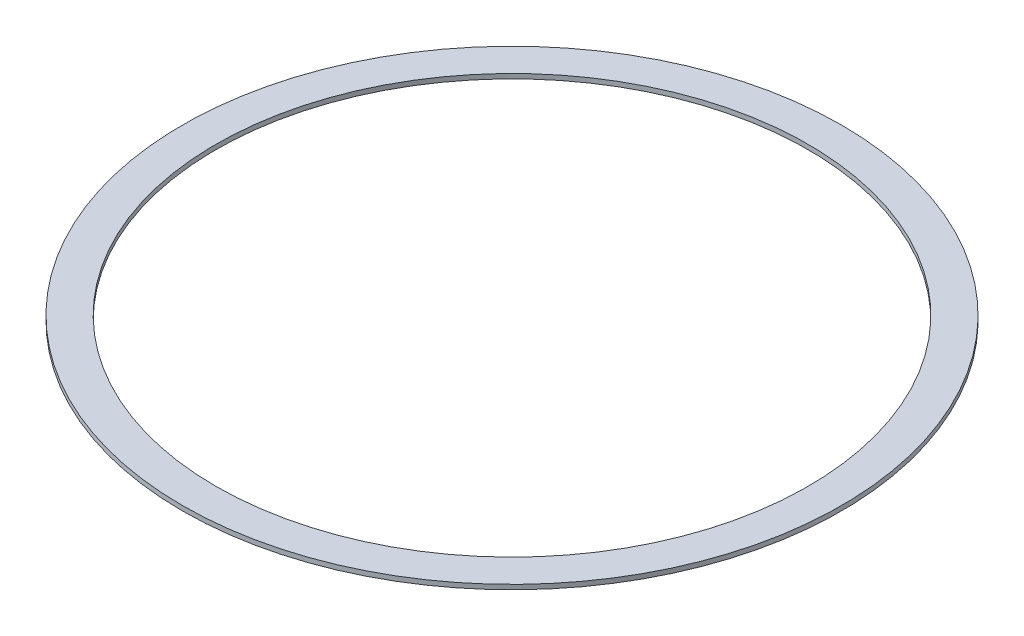
from build123d import *

# Parameters (mm, degrees)
SKETCH1_R           = 179.0446
SKETCH1_R_2         = 160.909
BOSS_EXTRUDE1_DEPTH = 2.54


with BuildPart() as part:
    # Sketch1 → Boss-Extrude1 (new body)
    with BuildSketch(Plane(origin=(0, 0, 0), x_dir=(1, 0, 0), z_dir=(0, 1, 0))):
        with Locations(Location((0, 0, 0), (0, 0, 270))):
            Circle(SKETCH1_R)
        with Locations(Location((0, 0, 0), (0, 0, 270))):
            Circle(SKETCH1_R_2, mode=Mode.SUBTRACT)
    extrude(amount=BOSS_EXTRUDE1_DEPTH)


solid = part.part
